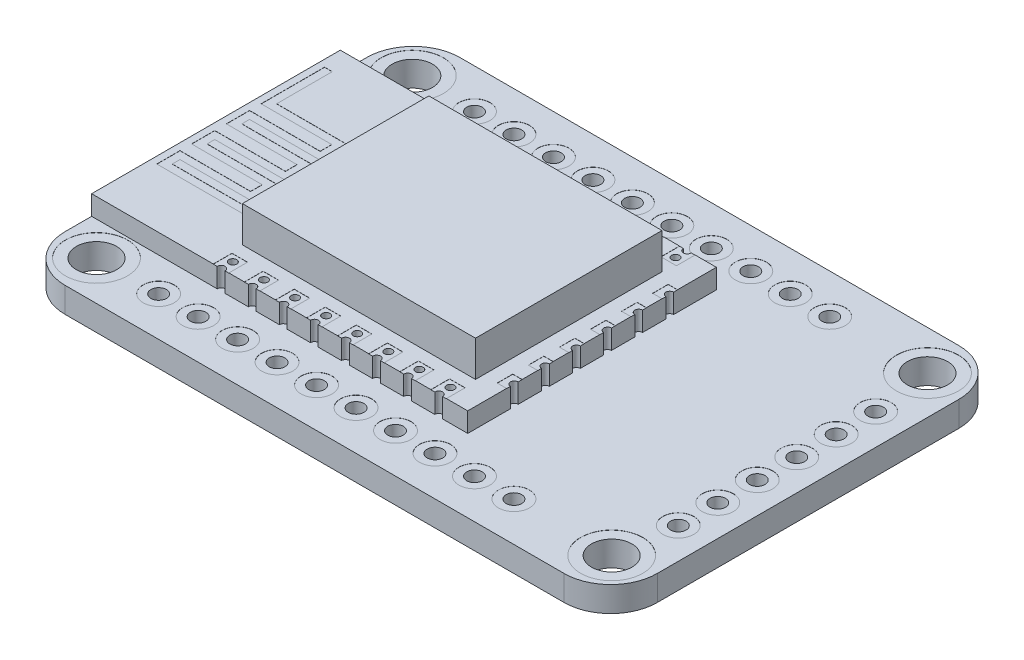
from build123d import *

# Parameters (mm, degrees)
SKETCH1_W           = 38.1
SKETCH1_H           = 25.4
BOSS_EXTRUDE1_DEPTH = 1.62
FILLET1_R           = 3
SKETCH2_R           = 1.3
CUT_EXTRUDE1_DEPTH  = 23.952492239
SKETCH4_R           = 2
CUT_EXTRUDE2_DEPTH  = 0.01
SKETCH3_R           = 0.5
CUT_EXTRUDE3_DEPTH  = 23.952492239
SKETCH6_R           = 1
CUT_EXTRUDE4_DEPTH  = 0.01
SKETCH7_W           = 24.2
SKETCH7_H           = 16
BOSS_EXTRUDE2_DEPTH = 1.26
SKETCH8_W           = 15
SKETCH8_H           = 12
BOSS_EXTRUDE3_DEPTH = 2.3
SKETCH9_R           = 0.25
CUT_EXTRUDE5_DEPTH  = 1.26
SKETCH10_W          = 1
SKETCH10_H          = 1.2
SKETCH10_W_2        = 0.6
SKETCH10_H_2        = 1
CUT_EXTRUDE6_DEPTH  = 0.01


with BuildPart() as part:
    # Sketch1 → Boss-Extrude1 (new body)
    with BuildSketch(Plane(origin=(0, 0, 0), x_dir=(1, 0, 0), z_dir=(0, 1, 0))):
        Rectangle(SKETCH1_W, SKETCH1_H)
    extrude(amount=BOSS_EXTRUDE1_DEPTH)

    # Fillet1
    fillet1_edges = [part.edges().sort_by_distance(p)[0] for p in [
        (19.05, 0.81, 12.7),
        (-19.05, 0.81, 12.7),
        (-19.05, 0.81, -12.7),
        (19.05, 0.81, -12.7),
    ]]
    fillet(fillet1_edges, radius=FILLET1_R)

    # Sketch2 → Cut-Extrude1 (cut, through all)
    with BuildSketch(Plane(origin=(0, 1.62, 0), x_dir=(1, 0, 0), z_dir=(0, 1, 0))):
        with Locations(Location((-16.575, 10.16, 0), (0, 0, 270))):
            Circle(SKETCH2_R)
        with Locations(Location((16.575, 10.16, 0), (0, 0, 90))):
            Circle(SKETCH2_R)
        with Locations(Location((16.575, -10.16, 0), (0, 0, 270))):
            Circle(SKETCH2_R)
        with Locations(Location((-16.575, -10.16, 0), (0, 0, 90))):
            Circle(SKETCH2_R)
    extrude(amount=-CUT_EXTRUDE1_DEPTH, mode=Mode.SUBTRACT)

    # Sketch4 → Cut-Extrude2 (cut)
    with BuildSketch(Plane(origin=(0, 1.62, 0), x_dir=(1, 0, 0), z_dir=(0, 1, 0))):
        with Locations(Location((16.575, 10.16, 0), (0, 0, 270))):
            Circle(SKETCH4_R)
        with Locations(Location((-16.575, 10.16, 0), (0, 0, 270))):
            Circle(SKETCH4_R)
        with Locations(Location((16.575, -10.16, 0), (0, 0, 270))):
            Circle(SKETCH4_R)
        with Locations(Location((-16.575, -10.16, 0), (0, 0, 270))):
            Circle(SKETCH4_R)
    extrude(amount=-CUT_EXTRUDE2_DEPTH, mode=Mode.SUBTRACT)

    # Sketch3 → Cut-Extrude3 (cut, through all)
    with BuildSketch(Plane(origin=(0, 1.62, 0), x_dir=(1, 0, 0), z_dir=(0, 1, 0))):
        with Locations(Location((-12.575, 10.16, 0), (0, 0, 270))):
            Circle(SKETCH3_R)
        with Locations(Location((-10.035, 10.16, 0), (0, 0, 270))):
            Circle(SKETCH3_R)
        with Locations(Location((-7.495, 10.16, 0), (0, 0, 270))):
            Circle(SKETCH3_R)
        with Locations(Location((-4.955, 10.16, 0), (0, 0, 270))):
            Circle(SKETCH3_R)
        with Locations(Location((-2.415, 10.16, 0), (0, 0, 270))):
            Circle(SKETCH3_R)
        with Locations(Location((0.125, 10.16, 0), (0, 0, 270))):
            Circle(SKETCH3_R)
        with Locations(Location((2.665, 10.16, 0), (0, 0, 270))):
            Circle(SKETCH3_R)
        with Locations(Location((5.205, 10.16, 0), (0, 0, 270))):
            Circle(SKETCH3_R)
        with Locations(Location((7.745, 10.16, 0), (0, 0, 270))):
            Circle(SKETCH3_R)
        with Locations(Location((10.285, 10.16, 0), (0, 0, 270))):
            Circle(SKETCH3_R)
        with Locations(Location((10.285, -10.16, 0), (0, 0, 90))):
            Circle(SKETCH3_R)
        with Locations(Location((7.745, -10.16, 0), (0, 0, 90))):
            Circle(SKETCH3_R)
        with Locations(Location((5.205, -10.16, 0), (0, 0, 90))):
            Circle(SKETCH3_R)
        with Locations(Location((2.665, -10.16, 0), (0, 0, 90))):
            Circle(SKETCH3_R)
        with Locations(Location((0.125, -10.16, 0), (0, 0, 90))):
            Circle(SKETCH3_R)
        with Locations(Location((-2.415, -10.16, 0), (0, 0, 90))):
            Circle(SKETCH3_R)
        with Locations(Location((-4.955, -10.16, 0), (0, 0, 90))):
            Circle(SKETCH3_R)
        with Locations(Location((-7.495, -10.16, 0), (0, 0, 90))):
            Circle(SKETCH3_R)
        with Locations(Location((-10.035, -10.16, 0), (0, 0, 90))):
            Circle(SKETCH3_R)
        with Locations(Location((-12.575, -10.16, 0), (0, 0, 90))):
            Circle(SKETCH3_R)
        with Locations(Location((17.05, 6.35, 0), (0, 0, 270))):
            Circle(SKETCH3_R)
        with Locations(Location((17.05, 3.81, 0), (0, 0, 270))):
            Circle(SKETCH3_R)
        with Locations(Location((17.05, 1.27, 0), (0, 0, 270))):
            Circle(SKETCH3_R)
        with Locations(Location((17.05, -1.27, 0), (0, 0, 270))):
            Circle(SKETCH3_R)
        with Locations(Location((17.05, -3.81, 0), (0, 0, 270))):
            Circle(SKETCH3_R)
        with Locations(Location((17.05, -6.35, 0), (0, 0, 270))):
            Circle(SKETCH3_R)
    extrude(amount=-CUT_EXTRUDE3_DEPTH, mode=Mode.SUBTRACT)

    # Sketch6 → Cut-Extrude4 (cut)
    with BuildSketch(Plane(origin=(0, 1.62, 0), x_dir=(1, 0, 0), z_dir=(0, 1, 0))):
        with Locations(Location((2.665, 10.16, 0), (0, 0, 270))):
            Circle(SKETCH6_R)
        with Locations(Location((0.125, 10.16, 0), (0, 0, 270))):
            Circle(SKETCH6_R)
        with Locations(Location((-2.415, 10.16, 0), (0, 0, 270))):
            Circle(SKETCH6_R)
        with Locations(Location((-4.955, 10.16, 0), (0, 0, 270))):
            Circle(SKETCH6_R)
        with Locations(Location((-7.495, 10.16, 0), (0, 0, 270))):
            Circle(SKETCH6_R)
        with Locations(Location((-10.035, 10.16, 0), (0, 0, 270))):
            Circle(SKETCH6_R)
        with Locations(Location((-12.575, 10.16, 0), (0, 0, 270))):
            Circle(SKETCH6_R)
        with Locations(Location((5.205, -10.16, 0), (0, 0, 270))):
            Circle(SKETCH6_R)
        with Locations(Location((7.745, -10.16, 0), (0, 0, 270))):
            Circle(SKETCH6_R)
        with Locations(Location((10.285, -10.16, 0), (0, 0, 270))):
            Circle(SKETCH6_R)
        with Locations(Location((10.285, 10.16, 0), (0, 0, 270))):
            Circle(SKETCH6_R)
        with Locations(Location((7.745, 10.16, 0), (0, 0, 270))):
            Circle(SKETCH6_R)
        with Locations(Location((5.205, 10.16, 0), (0, 0, 270))):
            Circle(SKETCH6_R)
        with Locations(Location((-12.575, -10.16, 0), (0, 0, 270))):
            Circle(SKETCH6_R)
        with Locations(Location((-10.035, -10.16, 0), (0, 0, 270))):
            Circle(SKETCH6_R)
        with Locations(Location((-7.495, -10.16, 0), (0, 0, 270))):
            Circle(SKETCH6_R)
        with Locations(Location((-4.955, -10.16, 0), (0, 0, 270))):
            Circle(SKETCH6_R)
        with Locations(Location((-2.415, -10.16, 0), (0, 0, 270))):
            Circle(SKETCH6_R)
        with Locations(Location((0.125, -10.16, 0), (0, 0, 270))):
            Circle(SKETCH6_R)
        with Locations(Location((2.665, -10.16, 0), (0, 0, 270))):
            Circle(SKETCH6_R)
        with Locations(Location((17.05, -3.81, 0), (0, 0, 270))):
            Circle(SKETCH6_R)
        with Locations(Location((17.05, -1.27, 0), (0, 0, 270))):
            Circle(SKETCH6_R)
        with Locations(Location((17.05, 1.27, 0), (0, 0, 270))):
            Circle(SKETCH6_R)
        with Locations(Location((17.05, 3.81, 0), (0, 0, 270))):
            Circle(SKETCH6_R)
        with Locations(Location((17.05, 6.35, 0), (0, 0, 270))):
            Circle(SKETCH6_R)
        with Locations(Location((17.05, -6.35, 0), (0, 0, 270))):
            Circle(SKETCH6_R)
    extrude(amount=-CUT_EXTRUDE4_DEPTH, mode=Mode.SUBTRACT)

    # Sketch7 → Boss-Extrude2 (add)
    with BuildSketch(Plane(origin=(0, 1.62, 0), x_dir=(1, 0, 0), z_dir=(0, 1, 0))):
        with Locations((-6.95, 0)):
            Rectangle(SKETCH7_W, SKETCH7_H)
    extrude(amount=BOSS_EXTRUDE2_DEPTH)

    # Sketch8 → Boss-Extrude3 (add)
    with BuildSketch(Plane(origin=(0, 2.88, 0), x_dir=(1, 0, 0), z_dir=(0, 1, 0))):
        with Locations((-3.85, 0)):
            Rectangle(SKETCH8_W, SKETCH8_H)
    extrude(amount=BOSS_EXTRUDE3_DEPTH)

    # Sketch9 → Cut-Extrude5 (cut)
    with BuildSketch(Plane(origin=(0, 2.88, 0), x_dir=(1, 0, 0), z_dir=(0, 1, 0))):
        with Locations(Location((-10.718623859, 7.241193887, 0), (0, 0, 270))):
            Circle(SKETCH9_R)
        with Locations(Location((-8.718623859, 7.241193887, 0), (0, 0, 270))):
            Circle(SKETCH9_R)
        with Locations(Location((-6.718623859, 7.241193887, 0), (0, 0, 270))):
            Circle(SKETCH9_R)
        with Locations(Location((-4.718623859, 7.241193887, 0), (0, 0, 270))):
            Circle(SKETCH9_R)
        with Locations(Location((-2.718623859, 7.241193887, 0), (0, 0, 270))):
            Circle(SKETCH9_R)
        with Locations(Location((-0.718623859, 7.241193887, 0), (0, 0, 270))):
            Circle(SKETCH9_R)
        with Locations(Location((1.281376141, 7.241193887, 0), (0, 0, 270))):
            Circle(SKETCH9_R)
        with Locations(Location((3.281376141, 7.241193887, 0), (0, 0, 270))):
            Circle(SKETCH9_R)
        with Locations((-8.718623859, 7.991193887)):
            Circle(SKETCH9_R)
        with Locations((-6.718623859, 7.991193887)):
            Circle(SKETCH9_R)
        with Locations((-4.718623859, 7.991193887)):
            Circle(SKETCH9_R)
        with Locations((-2.718623859, 7.991193887)):
            Circle(SKETCH9_R)
        with Locations((-0.718623859, 7.991193887)):
            Circle(SKETCH9_R)
        with Locations((1.281376141, 7.991193887)):
            Circle(SKETCH9_R)
        with Locations((3.281376141, 7.991193887)):
            Circle(SKETCH9_R)
        with Locations((-10.718623859, 7.991193887)):
            Circle(SKETCH9_R)
        with Locations((-10.718623859, -7.991193887)):
            Circle(SKETCH9_R)
        with Locations((3.281376141, -7.991193887)):
            Circle(SKETCH9_R)
        with Locations((1.281376141, -7.991193887)):
            Circle(SKETCH9_R)
        with Locations((-0.718623859, -7.991193887)):
            Circle(SKETCH9_R)
        with Locations((-2.718623859, -7.991193887)):
            Circle(SKETCH9_R)
        with Locations((-4.718623859, -7.991193887)):
            Circle(SKETCH9_R)
        with Locations((-6.718623859, -7.991193887)):
            Circle(SKETCH9_R)
        with Locations((-8.718623859, -7.991193887)):
            Circle(SKETCH9_R)
        with Locations(Location((3.281376141, -7.241193887, 0), (0, 0, 90))):
            Circle(SKETCH9_R)
        with Locations(Location((1.281376141, -7.241193887, 0), (0, 0, 90))):
            Circle(SKETCH9_R)
        with Locations(Location((-0.718623859, -7.241193887, 0), (0, 0, 90))):
            Circle(SKETCH9_R)
        with Locations(Location((-2.718623859, -7.241193887, 0), (0, 0, 90))):
            Circle(SKETCH9_R)
        with Locations(Location((-4.718623859, -7.241193887, 0), (0, 0, 90))):
            Circle(SKETCH9_R)
        with Locations(Location((-6.718623859, -7.241193887, 0), (0, 0, 90))):
            Circle(SKETCH9_R)
        with Locations(Location((-8.718623859, -7.241193887, 0), (0, 0, 90))):
            Circle(SKETCH9_R)
        with Locations(Location((-10.718623859, -7.241193887, 0), (0, 0, 90))):
            Circle(SKETCH9_R)
        with Locations((5.15, 5)):
            Circle(SKETCH9_R)
        with Locations((5.15, 3)):
            Circle(SKETCH9_R)
        with Locations((5.15, 1)):
            Circle(SKETCH9_R)
        with Locations((5.15, -1)):
            Circle(SKETCH9_R)
        with Locations((5.15, -3)):
            Circle(SKETCH9_R)
        with Locations((5.15, -5)):
            Circle(SKETCH9_R)
    extrude(amount=-CUT_EXTRUDE5_DEPTH, mode=Mode.SUBTRACT)

    # Sketch10 → Cut-Extrude6 (cut)
    with BuildSketch(Plane(origin=(0, 2.88, 0), x_dir=(1, 0, 0), z_dir=(0, 1, 0))):
        with Locations((-10.718623859, 7.4)):
            Rectangle(SKETCH10_W, SKETCH10_H)
        with Locations((-8.718623859, 7.4)):
            Rectangle(SKETCH10_W, SKETCH10_H)
        with Locations((-6.718623859, 7.4)):
            Rectangle(SKETCH10_W, SKETCH10_H)
        with Locations((-4.718623859, 7.4)):
            Rectangle(SKETCH10_W, SKETCH10_H)
        with Locations((-2.718623859, 7.4)):
            Rectangle(SKETCH10_W, SKETCH10_H)
        with Locations((-0.718623859, 7.4)):
            Rectangle(SKETCH10_W, SKETCH10_H)
        with Locations((1.281376141, 7.4)):
            Rectangle(SKETCH10_W, SKETCH10_H)
        with Locations((3.281376141, 7.4)):
            Rectangle(SKETCH10_W, SKETCH10_H)
        with Locations((3.281376141, -7.4)):
            Rectangle(SKETCH10_W, SKETCH10_H)
        with Locations((1.281376141, -7.4)):
            Rectangle(SKETCH10_W, SKETCH10_H)
        with Locations((-0.718623859, -7.4)):
            Rectangle(SKETCH10_W, SKETCH10_H)
        with Locations((-2.718623859, -7.4)):
            Rectangle(SKETCH10_W, SKETCH10_H)
        with Locations((-4.718623859, -7.4)):
            Rectangle(SKETCH10_W, SKETCH10_H)
        with Locations((-6.718623859, -7.4)):
            Rectangle(SKETCH10_W, SKETCH10_H)
        with Locations((-8.718623859, -7.4)):
            Rectangle(SKETCH10_W, SKETCH10_H)
        with Locations((-10.718623859, -7.4)):
            Rectangle(SKETCH10_W, SKETCH10_H)
        with Locations((4.85, 5)):
            Rectangle(SKETCH10_W_2, SKETCH10_H_2)
        with Locations((4.85, 3)):
            Rectangle(SKETCH10_W_2, SKETCH10_H_2)
        with Locations((4.85, 1)):
            Rectangle(SKETCH10_W_2, SKETCH10_H_2)
        with Locations((4.85, -1)):
            Rectangle(SKETCH10_W_2, SKETCH10_H_2)
        with Locations((4.85, -3)):
            Rectangle(SKETCH10_W_2, SKETCH10_H_2)
        with Locations((4.85, -5)):
            Rectangle(SKETCH10_W_2, SKETCH10_H_2)
        Polygon((-18.608220194, 6.548473932), (-18.608220194, 2.46583574), (-14.065009718, 2.46583574), (-14.065009718, 1.721181756), (-18.608220194, 1.721181756), (-18.608220194, 0.228171299), (-14.065009718, 0.228171299), (-14.065009718, -0.516482684), (-18.608220194, -0.516482684), (-18.608220194, -2.009493142), (-14.065009718, -2.009493142), (-14.065009718, -2.754147125), (-18.608220194, -2.754147125), (-18.608220194, -4.247157583), (-11.848454591, -4.247157583), (-11.848454591, 2.46583574), (-12.348454591, 2.46583574), (-12.348454591, -3.747157583), (-18.108220194, -3.747157583), (-18.108220194, -3.254147125), (-13.565009718, -3.254147125), (-13.565009718, -1.509493142), (-18.108220194, -1.509493142), (-18.108220194, -1.016482684), (-13.565009718, -1.016482684), (-13.565009718, 0.728171299), (-18.108220194, 0.728171299), (-18.108220194, 1.221181756), (-13.565009718, 1.221181756), (-13.565009718, 2.96583574), (-18.108220194, 2.96583574), (-18.108220194, 6.548473932), align=None)
    extrude(amount=-CUT_EXTRUDE6_DEPTH, mode=Mode.SUBTRACT)


solid = part.part
